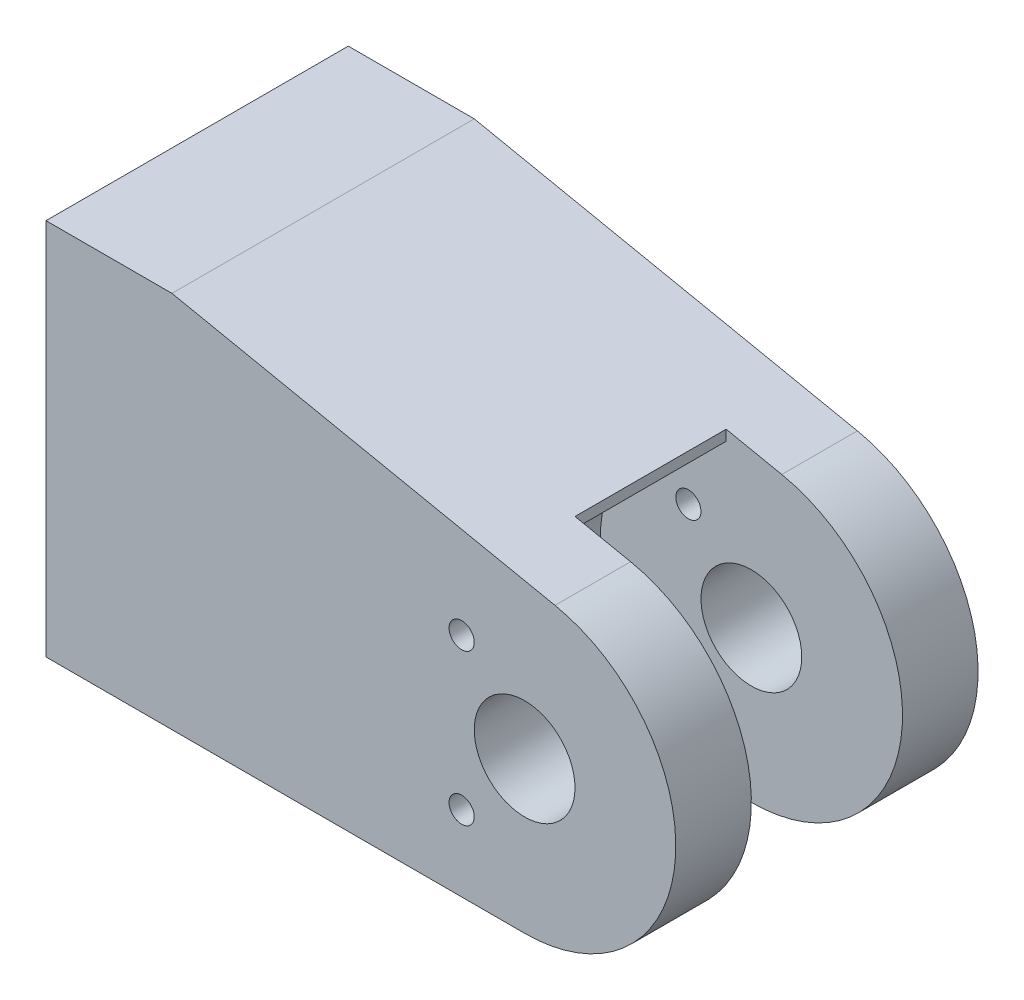
from build123d import *

# Parameters (mm, degrees)
SKETCH1_R           = 2
BOSS_EXTRUDE1_DEPTH = 6
CUT_EXTRUDE1_DEPTH  = 3
SKETCH7_R           = 1.984375
CUT_EXTRUDE3_DEPTH  = 6
SKETCH16_W          = 15.013819635
SKETCH16_H          = 6
CUT_EXTRUDE7_DEPTH  = 30.765752132
SKETCH19_R          = 0.5
CUT_EXTRUDE10_DEPTH = 32.527765541
CUT_EXTRUDE13_DEPTH = 3


with BuildPart() as part:
    # Sketch1 → Boss-Extrude1 (new, symmetric)
    with BuildSketch(Plane.XY):
        with BuildLine():
            Line((0, 0), (19, 0))
            ThreePointArc((19, 0), (24.969263034, 5.393453355), (20.206878822, 11.877367056))
            Line((20.206878822, 11.877367056), (5, 15))
            Line((5, 15), (0, 15))
            Line((0, 15), (0, 0))
        make_face()
        with Locations((19, 6)):
            Circle(SKETCH1_R, mode=Mode.SUBTRACT)
    extrude(amount=BOSS_EXTRUDE1_DEPTH, both=True)

    # Sketch2 → Cut-Extrude1 (cut, symmetric)
    with BuildSketch(Plane.XY):
        with BuildLine():
            ThreePointArc((19, 0), (25, 6), (19, 12))
            ThreePointArc((19, 12), (13, 6), (19, 0))
        make_face()
    extrude(amount=CUT_EXTRUDE1_DEPTH, both=True, mode=Mode.SUBTRACT)

    # Sketch7 → Cut-Extrude3 (cut)
    with BuildSketch(Plane.ZY):
        with Locations((-0.32, 10.85)):
            Circle(SKETCH7_R)
        with Locations((-0.32, 4.85)):
            Circle(SKETCH7_R)
    extrude(amount=-CUT_EXTRUDE3_DEPTH, mode=Mode.SUBTRACT)

    # Sketch16 → Cut-Extrude7 (cut, through all)
    with BuildSketch(Plane.XZ):
        with Locations((25.506909818, 0)):
            Rectangle(SKETCH16_W, SKETCH16_H)
    extrude(amount=-CUT_EXTRUDE7_DEPTH, mode=Mode.SUBTRACT)

    # Sketch19 → Cut-Extrude10 (cut, through all)
    with BuildSketch(Plane.XY.offset(6)):
        with Locations((16.5, 3)):
            Circle(SKETCH19_R)
        with Locations((16.5, 9)):
            Circle(SKETCH19_R)
    extrude(amount=-CUT_EXTRUDE10_DEPTH, mode=Mode.SUBTRACT)

    # Sketch23 → Cut-Extrude13 (cut, symmetric)
    with BuildSketch(Plane.XY):
        Polygon((18, 0), (18, 1.5), (16, 1.5), (15, 0), align=None)
    extrude(amount=CUT_EXTRUDE13_DEPTH, both=True, mode=Mode.SUBTRACT)


solid = part.part
